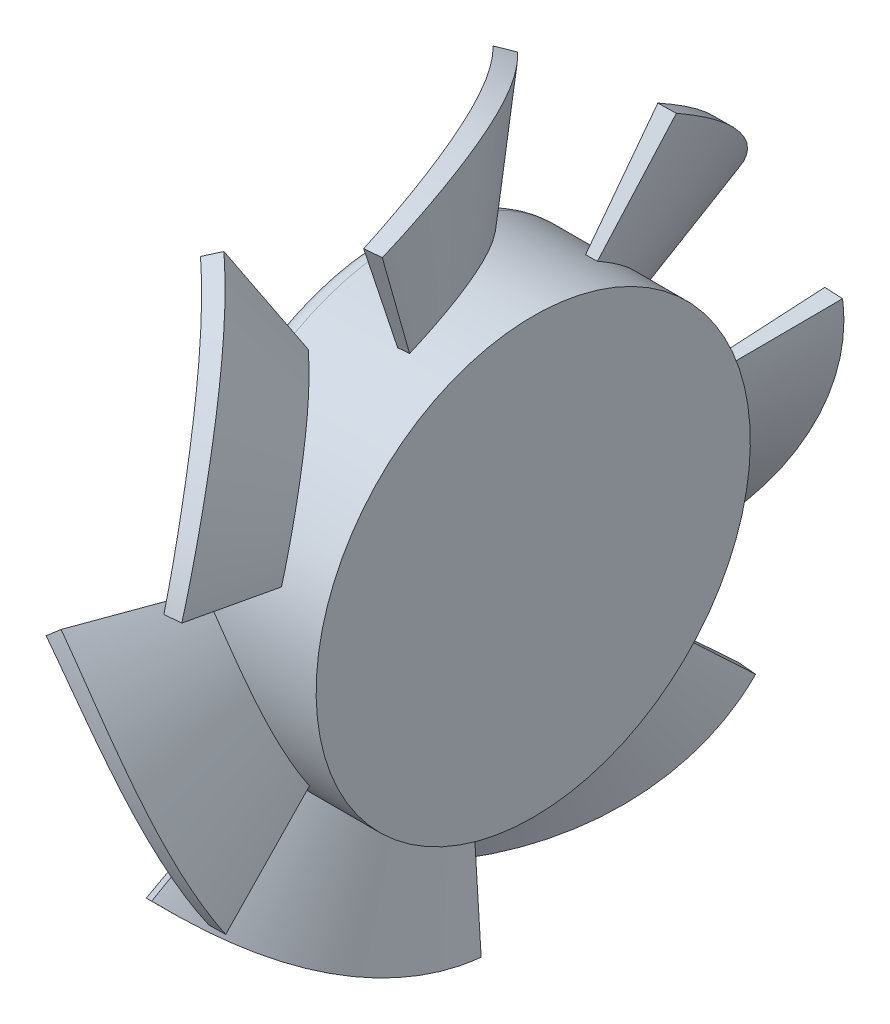
from build123d import *

# Parameters (mm, degrees)
SKETCH5_W                  = 8
SKETCH5_H                  = 11.5
CIRPATTERN1_COUNT          = 7
SKETCH_CUT_BLADE_OUTSIDE_W = 50.999
SKETCH_CUT_BLADE_OUTSIDE_H = 50.116
SKETCH_CUT_BLADE_OUTSIDE_R = 18
CUT_FAN_BLADE_DEPTH        = 30.009117079
COSMETIC_FILLET_R          = 1


with BuildPart() as part:
    # Sketch5 → Body (revolve)
    with BuildSketch(Plane.XY, mode=Mode.PRIVATE) as body_sk:
        with Locations((-6, 5.75)):
            Rectangle(SKETCH5_W, SKETCH5_H)
    revolve(body_sk.sketch.rotate(Axis((-10, 0, 0), (1, 0, 0)), 180), axis=Axis((-10, 0, 0), (1, 0, 0)))

    # Sketch-Blade-Top → Loft-Fan-Blade section 0
    with BuildSketch(Plane(origin=(0, 18, 0), x_dir=(-1, 0, 0), z_dir=(0, 1, 0)), mode=Mode.PRIVATE) as loft_fan_blade_s0:
        with BuildLine():
            Line((4.220534784, 7.137045162), (3.222970733, 7.067288688))
            ThreePointArc((3.222970733, 7.067288688), (5.086454542, -0.406736643), (9.393823742, -6.792674095))
            Line((9.393823742, -6.792674095), (10.113163542, -6.098015725))
            ThreePointArc((10.113163542, -6.098015725), (6, 0), (4.220534784, 7.137045162))
        make_face()
    loft_fan_blade = loft([loft_fan_blade_s0.sketch, Vertex(-6, 0, 0)])

    # CirPattern1: Loft-Fan-Blade ×7 about axis
    cirpattern1_axis = Axis((-10, 0, 0), (1, 0, 0))
    for i in range(1, CIRPATTERN1_COUNT):
        add(loft_fan_blade.rotate(cirpattern1_axis, i * 360 / CIRPATTERN1_COUNT))

    # Sketch-Cut-Blade outside → Cut-Fan-Blade (cut, through all)
    with BuildSketch(Plane(origin=(0, 0, 0), x_dir=(0, 0, -1), z_dir=(1, 0, 0))):
        with Locations((0.0385, -0.657)):
            Rectangle(SKETCH_CUT_BLADE_OUTSIDE_W, SKETCH_CUT_BLADE_OUTSIDE_H)
        Circle(SKETCH_CUT_BLADE_OUTSIDE_R, mode=Mode.SUBTRACT)
    extrude(amount=-CUT_FAN_BLADE_DEPTH, mode=Mode.SUBTRACT)

    # Cosmetic-Fillet
    cosmetic_fillet_edges = [part.edges().sort_by_distance(p)[0] for p in [
        (-10, 11.5, 0),
    ]]
    fillet(cosmetic_fillet_edges, radius=COSMETIC_FILLET_R)


solid = part.part
